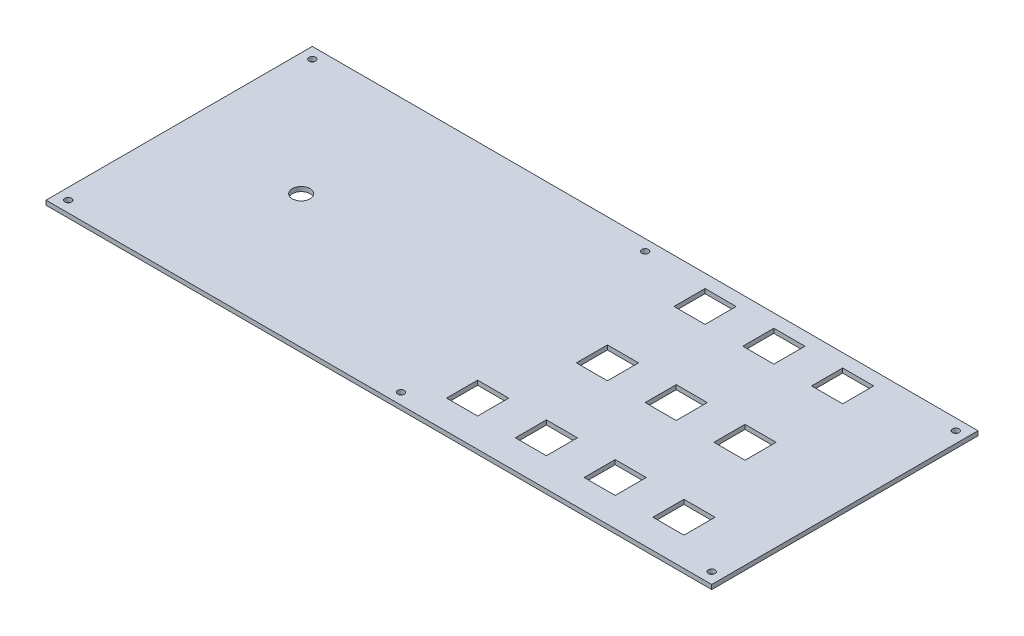
from build123d import *

# Parameters (mm, degrees)
SKETCH1_W           = 300
SKETCH1_H           = 120
SKETCH1_R           = 4
SKETCH1_R_2         = 1.5
SKETCH1_W_2         = 14
SKETCH1_H_2         = 14
BOSS_EXTRUDE1_DEPTH = 2


with BuildPart() as part:
    # Sketch1 → Boss-Extrude1 (new body)
    with BuildSketch(Plane(origin=(0, 0, 0), x_dir=(1, 0, 0), z_dir=(0, 1, 0))):
        Rectangle(SKETCH1_W, SKETCH1_H)
        with Locations(Location((-95, 0, 0), (0, 0, 270))):
            Circle(SKETCH1_R, mode=Mode.SUBTRACT)
        with Locations(Location((-145, 55, 0), (0, 0, 270))):
            Circle(SKETCH1_R_2, mode=Mode.SUBTRACT)
        with Locations(Location((145, 55, 0), (0, 0, 90))):
            Circle(SKETCH1_R_2, mode=Mode.SUBTRACT)
        with Locations(Location((-145, -55, 0), (0, 0, 90))):
            Circle(SKETCH1_R_2, mode=Mode.SUBTRACT)
        with Locations(Location((145, -55, 0), (0, 0, 270))):
            Circle(SKETCH1_R_2, mode=Mode.SUBTRACT)
        with Locations(Location((5, 55, 0), (0, 0, 270))):
            Circle(SKETCH1_R_2, mode=Mode.SUBTRACT)
        with Locations(Location((5, -55, 0), (0, 0, 90))):
            Circle(SKETCH1_R_2, mode=Mode.SUBTRACT)
        with Locations((24.5, -40)):
            Rectangle(SKETCH1_W_2, SKETCH1_H_2, mode=Mode.SUBTRACT)
        with Locations((40, 3)):
            Rectangle(SKETCH1_W_2, SKETCH1_H_2, mode=Mode.SUBTRACT)
        with Locations((71, 3)):
            Rectangle(SKETCH1_W_2, SKETCH1_H_2, mode=Mode.SUBTRACT)
        with Locations((102, 3)):
            Rectangle(SKETCH1_W_2, SKETCH1_H_2, mode=Mode.SUBTRACT)
        with Locations((55.5, -40)):
            Rectangle(SKETCH1_W_2, SKETCH1_H_2, mode=Mode.SUBTRACT)
        with Locations((86.5, -40)):
            Rectangle(SKETCH1_W_2, SKETCH1_H_2, mode=Mode.SUBTRACT)
        with Locations((117.5, -40)):
            Rectangle(SKETCH1_W_2, SKETCH1_H_2, mode=Mode.SUBTRACT)
        with Locations((40, 47)):
            Rectangle(SKETCH1_W_2, SKETCH1_H_2, mode=Mode.SUBTRACT)
        with Locations((71, 47)):
            Rectangle(SKETCH1_W_2, SKETCH1_H_2, mode=Mode.SUBTRACT)
        with Locations((102, 47)):
            Rectangle(SKETCH1_W_2, SKETCH1_H_2, mode=Mode.SUBTRACT)
    extrude(amount=BOSS_EXTRUDE1_DEPTH)


solid = part.part
